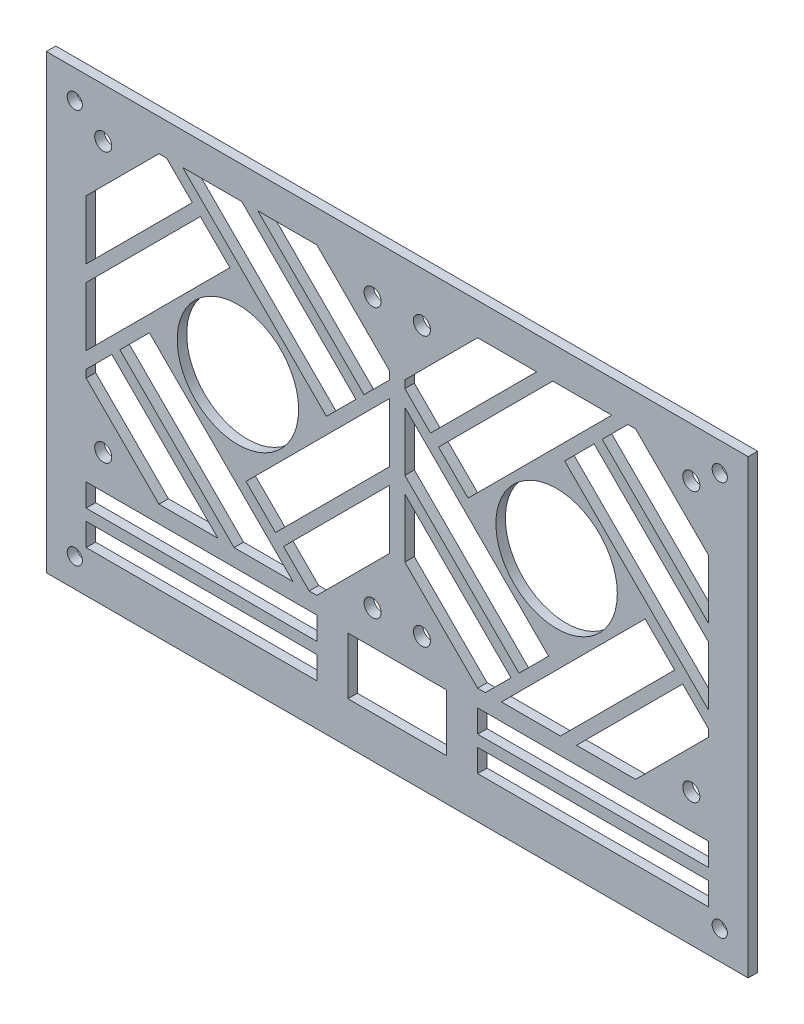
from build123d import *

# Parameters (mm, degrees)
SKETCH1_W               = 185
SKETCH1_H               = 115
BOSS_EXTRUDE1_DEPTH     = 2.5
SKETCH2_R               = 16
CUT_EXTRUDE1_DEPTH      = 114.369969569
SKETCH5_W               = 26
SKETCH5_H               = 15
CUT_EXTRUDE4_DEPTH      = 10
CUT_EXTRUDE7_DEPTH      = 10
SKETCH9_W               = 60.811183182
SKETCH9_H               = 6
CUT_EXTRUDE8_DEPTH      = 10
CUT_EXTRUDE9_DEPTH      = 114.369969569
CUT_EXTRUDE9_DEPTH_BACK = 114.369969569
SKETCH10_R              = 2.25
SKETCH11_R              = 2
CUT_EXTRUDE11_DEPTH     = 114.369969569
SKETCH12_W              = 185
SKETCH12_H              = 4
BOSS_EXTRUDE2_DEPTH     = 2.5


with BuildPart() as part:
    # Sketch1 → Boss-Extrude1 (new body)
    with BuildSketch(Plane.XY):
        with Locations((0, -8)):
            Rectangle(SKETCH1_W, SKETCH1_H)
    extrude(amount=BOSS_EXTRUDE1_DEPTH)

    # Sketch2 → Cut-Extrude1 (cut, through all)
    with BuildSketch(Plane.XY.offset(2.5)):
        with Locations((-42, 5)):
            Circle(SKETCH2_R)
        with Locations((42, 5)):
            Circle(SKETCH2_R)
    extrude(amount=-CUT_EXTRUDE1_DEPTH, mode=Mode.SUBTRACT)

    # Sketch5 → Cut-Extrude4 (cut)
    with BuildSketch(Plane.XY.offset(2.5)):
        with Locations((0, -47)):
            Rectangle(SKETCH5_W, SKETCH5_H)
    extrude(amount=-CUT_EXTRUDE4_DEPTH, mode=Mode.SUBTRACT)

    # Sketch8 → Cut-Extrude7 (cut)
    with BuildSketch(Plane.XY.offset(2.5)):
        Polygon((-82, 10.254833996), (-54.02081528, 38.234018716), (-60.786796564, 45), (-62.811183182, 45), (-82, 25.811183182), align=None)
        Polygon((-82, 6.012193309), (-51.899494937, 36.112698372), (-44.121320344, 28.334523779), (-82, -9.544155877), align=None)
        Polygon((-21.188816818, -35), (-2, -15.811183182), (-2, -0.254833996), (-29.97918472, -28.234018716), (-23.213203436, -35), align=None)
        Polygon((-43.012193309, -35), (-73.112698372, -4.899494937), (-65.334523779, 2.878679656), (-27.455844123, -35), align=None)
        Polygon((-82, -13.786796564), (-75.234018716, -7.02081528), (-47.254833996, -35), (-62.811183182, -35), (-82, -15.811183182), align=None)
        Polygon((-18.665476221, 7.121320344), (-56.544155877, 45), (-40.987806691, 45), (-10.887301628, 14.899494937), align=None)
        Polygon((-2, 25.811183182), (-21.188816818, 45), (-36.745166004, 45), (-8.765981284, 17.02081528), (-2, 23.786796564), align=None)
        Polygon((-2, 3.987806691), (-2, 19.544155877), (-39.878679656, -18.334523779), (-32.100505063, -26.112698372), align=None)
        Polygon((39.878679656, -18.334523779), (2, 19.544155877), (2, 3.987806691), (32.100505063, -26.112698372), align=None)
        Polygon((29.97918472, -28.234018716), (23.213203436, -35), (21.188816818, -35), (2, -15.811183182), (2, -0.254833996), align=None)
        Polygon((54.02081528, 38.234018716), (60.786796564, 45), (62.811183182, 45), (82, 25.811183182), (82, 10.254833996), align=None)
        Polygon((2, 23.786796564), (2, 25.811183182), (21.188816818, 45), (36.745166004, 45), (8.765981284, 17.02081528), align=None)
        Polygon((56.544155877, 45), (40.987806691, 45), (10.887301628, 14.899494937), (18.665476221, 7.121320344), align=None)
        Polygon((44.121320344, 28.334523779), (51.899494937, 36.112698372), (82, 6.012193309), (82, -9.544155877), align=None)
        Polygon((62.811183182, -35), (82, -15.811183182), (82, -13.786796564), (75.234018716, -7.02081528), (47.254833996, -35), align=None)
        Polygon((43.012193309, -35), (27.455844123, -35), (65.334523779, 2.878679656), (73.112698372, -4.899494937), align=None)
    extrude(amount=-CUT_EXTRUDE7_DEPTH, mode=Mode.SUBTRACT)

    # Sketch9 → Cut-Extrude8 (cut)
    with BuildSketch(Plane.XY.offset(2.5)):
        with Locations((-51.594408409, -42.5)):
            Rectangle(SKETCH9_W, SKETCH9_H)
        with Locations((51.594408409, -42.5)):
            Rectangle(SKETCH9_W, SKETCH9_H)
        with Locations((-51.594408409, -51.5)):
            Rectangle(SKETCH9_W, SKETCH9_H)
        with Locations((51.594408409, -51.5)):
            Rectangle(SKETCH9_W, SKETCH9_H)
    extrude(amount=-CUT_EXTRUDE8_DEPTH, mode=Mode.SUBTRACT)

    # Sketch10 → Cut-Extrude9 (cut, two sides: drawn at the far end of the back side and taken through both)
    with BuildSketch(Plane.XY.offset(2.5).offset(-CUT_EXTRUDE9_DEPTH_BACK)):
        with Locations((-77.5, 40.5)):
            Circle(SKETCH10_R)
        with Locations((-6.5, 40.5)):
            Circle(SKETCH10_R)
        with Locations((-6.5, -30.5)):
            Circle(SKETCH10_R)
        with Locations((-77.5, -30.5)):
            Circle(SKETCH10_R)
        with Locations(Location((77.5, -30.5, 0), (0, 0, 180))):
            Circle(SKETCH10_R)
        with Locations(Location((6.5, -30.5, 0), (0, 0, 180))):
            Circle(SKETCH10_R)
        with Locations(Location((6.5, 40.5, 0), (0, 0, 180))):
            Circle(SKETCH10_R)
        with Locations(Location((77.5, 40.5, 0), (0, 0, 180))):
            Circle(SKETCH10_R)
    extrude(amount=CUT_EXTRUDE9_DEPTH + CUT_EXTRUDE9_DEPTH_BACK, mode=Mode.SUBTRACT)

    # Sketch11 → Cut-Extrude11 (cut, through all)
    with BuildSketch(Plane.XY.offset(2.5)):
        with Locations((-85, 46)):
            Circle(SKETCH11_R)
        with Locations((85, 46)):
            Circle(SKETCH11_R)
        with Locations((85, -58)):
            Circle(SKETCH11_R)
        with Locations((-85, -58)):
            Circle(SKETCH11_R)
    extrude(amount=-CUT_EXTRUDE11_DEPTH, mode=Mode.SUBTRACT)

    # Sketch12 → Boss-Extrude2 (add)
    with BuildSketch(Plane.XY.offset(2.5)):
        with Locations((0, 51.5)):
            Rectangle(SKETCH12_W, SKETCH12_H)
    extrude(amount=-BOSS_EXTRUDE2_DEPTH)


solid = part.part
